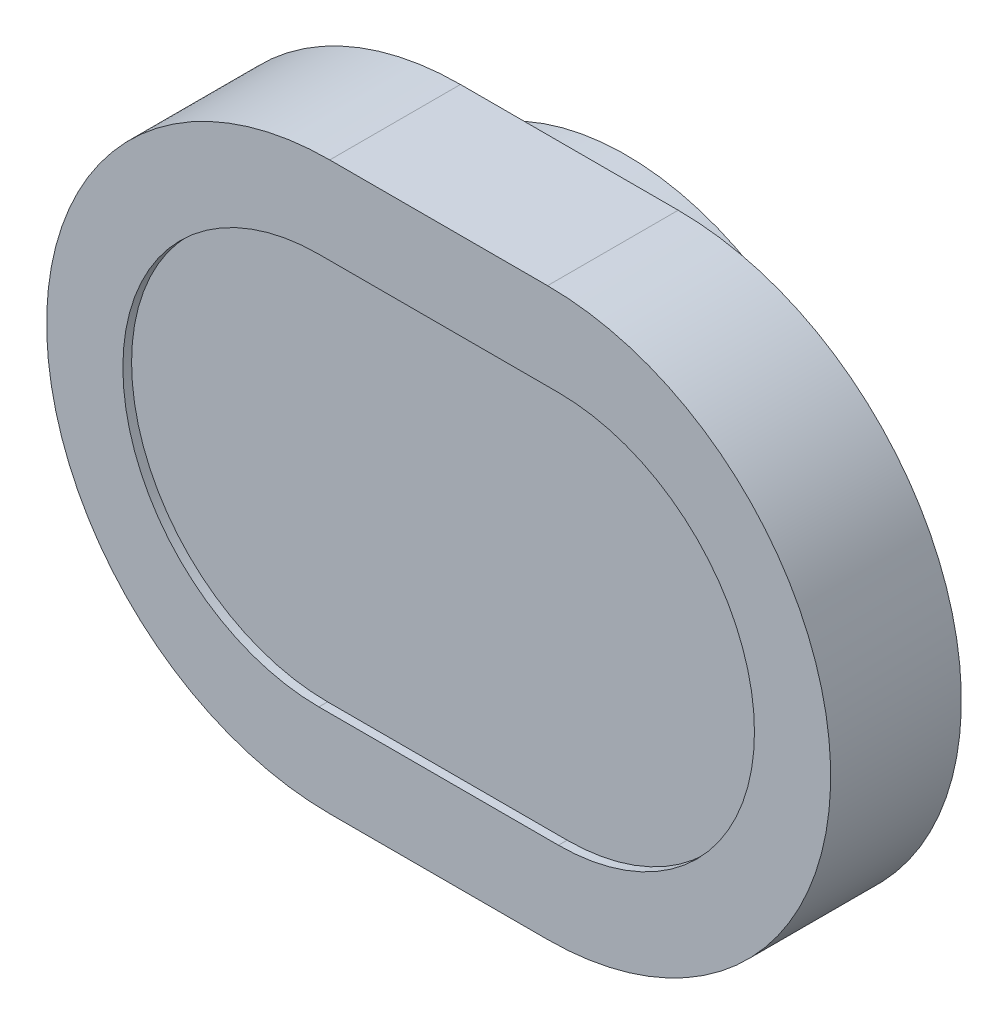
from build123d import *

# Parameters (mm, degrees)
SKETCH_1_R      = 5.7
EXTRUDE_1_DEPTH = 1.3
EXTRUDE_2_DEPTH = 2.8
EXTRUDE_3_DEPTH = 0.2


with BuildPart() as part:
    # Эскиз1 → Бобышка-Вытянуть1 (new body)
    with BuildSketch(Plane.XY):
        Circle(SKETCH_1_R)
    extrude(amount=EXTRUDE_1_DEPTH)

    # Эскиз2 → Бобышка-Вытянуть2 (add)
    with BuildSketch(Plane.XY.offset(1.3)):
        with BuildLine():
            Line((-2.5, 6.5), (2.5, 6.5))
            ThreePointArc((2.5, 6.5), (9, 0), (2.5, -6.5))
            Line((2.5, -6.5), (-2.5, -6.5))
            ThreePointArc((-2.5, -6.5), (-9, 0), (-2.5, 6.5))
        make_face()
    extrude(amount=EXTRUDE_2_DEPTH)

    # Эскиз3 → Бобышка-Вытянуть3 (add)
    with BuildSketch(Plane.XY.offset(4.1)):
        with BuildLine():
            Line((-2.5, 6.5), (2.5, 6.5))
            ThreePointArc((2.5, 6.5), (9, 0), (2.5, -6.5))
            Line((2.5, -6.5), (-2.5, -6.5))
            ThreePointArc((-2.5, -6.5), (-9, 0), (-2.5, 6.5))
        make_face()
        with BuildLine():
            Line((-2.75, 4.5), (2.75, 4.5))
            ThreePointArc((2.75, 4.5), (7.25, 0), (2.75, -4.5))
            Line((2.75, -4.5), (-2.75, -4.5))
            ThreePointArc((-2.75, -4.5), (-7.25, 0), (-2.75, 4.5))
        make_face(mode=Mode.SUBTRACT)
    extrude(amount=EXTRUDE_3_DEPTH)


solid = part.part
